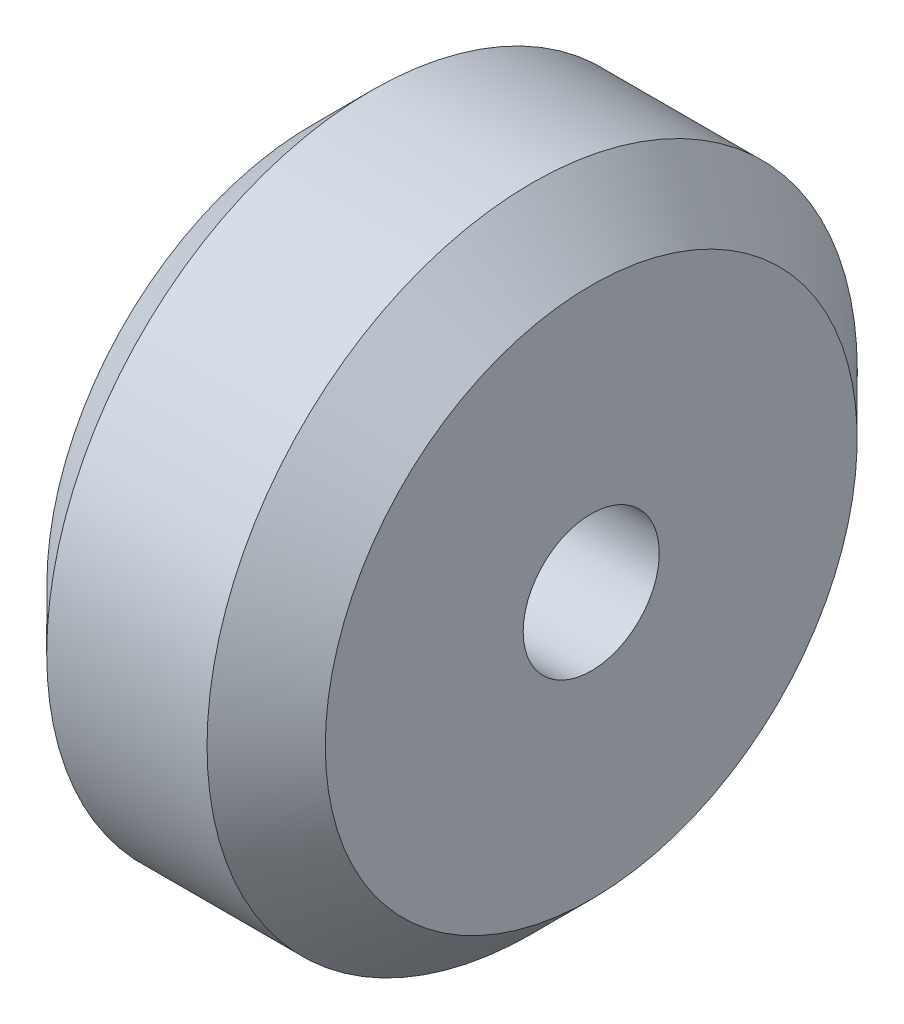
from build123d import *


with BuildPart() as part:
    # Croquis1 → Revolución1 (revolve)
    with BuildSketch(Plane.XY, mode=Mode.PRIVATE) as revoluci_n1_sk:
        Polygon((10.23, 2.5), (10.23, 9.77), (8.06, 11.945), (2.17, 11.945), (0, 9.77), (0, 2.5), align=None)
    revolve(revoluci_n1_sk.sketch.rotate(Axis((0, 0, 0), (1, 0, 0)), 90), axis=Axis((0, 0, 0), (1, 0, 0)))


solid = part.part
